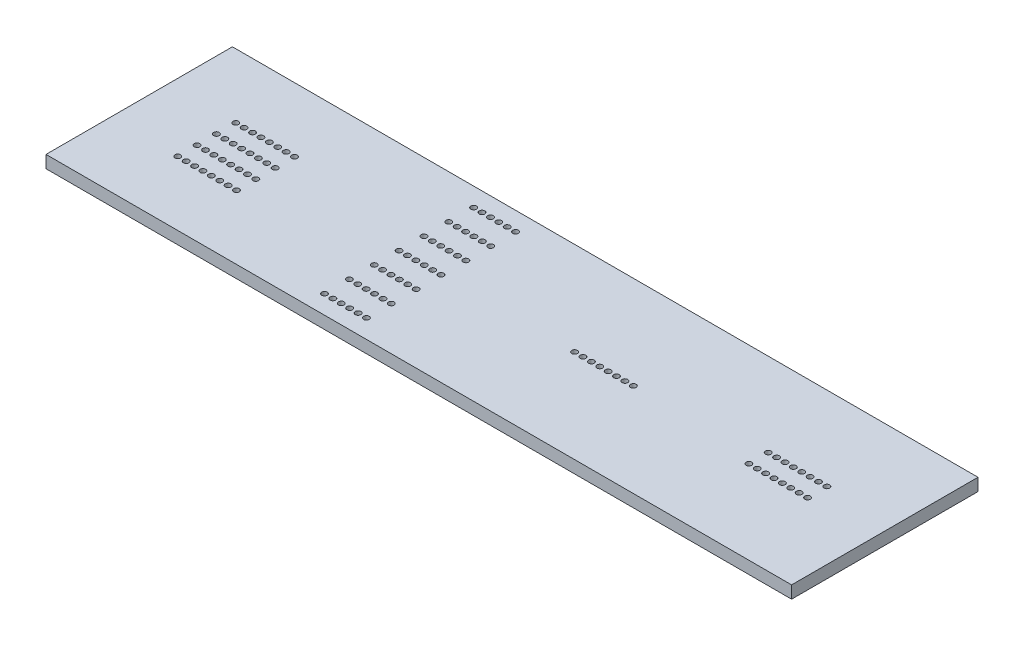
from build123d import *

# Parameters (mm, degrees)
ESQUISSE2_W                     = 120
ESQUISSE2_H                     = 30
BOSS_EXTRU_1_DEPTH              = 2
ENL_V_MAT_EXTRU_3_REACH         = 63.879
ESQUISSE8_R                     = 0.45
R_P_TITION_LIN_AIRE4_COUNT      = 8
R_P_TITION_LIN_AIRE4_PITCH      = 1.35
R_P_TITION_LIN_AIRE4_COUNT_DIR2 = 4
R_P_TITION_LIN_AIRE4_PITCH_DIR2 = 3.111
ENL_V_MAT_EXTRU_4_REACH         = 63.879
ESQUISSE10_R                    = 0.45
R_P_TITION_LIN_AIRE5_COUNT      = 6
R_P_TITION_LIN_AIRE5_PITCH      = 1.35
R_P_TITION_LIN_AIRE5_COUNT_DIR2 = 7
R_P_TITION_LIN_AIRE5_PITCH_DIR2 = 4
ENL_V_MAT_EXTRU_5_REACH         = 63.879
ESQUISSE12_R                    = 0.45
R_P_TITION_LIN_AIRE6_COUNT      = 8
R_P_TITION_LIN_AIRE6_PITCH      = 1.35
ENL_V_MAT_EXTRU_6_REACH         = 63.879
ESQUISSE14_R                    = 0.45
R_P_TITION_LIN_AIRE7_COUNT      = 8
R_P_TITION_LIN_AIRE7_PITCH      = 1.35
R_P_TITION_LIN_AIRE7_COUNT_DIR2 = 2
R_P_TITION_LIN_AIRE7_PITCH_DIR2 = 3.11


with BuildPart() as part:
    # Esquisse2 → Boss.-Extru.1 (new body)
    with BuildSketch(Plane(origin=(0, 0, 0), x_dir=(1, 0, 0), z_dir=(0, 1, 0))):
        Rectangle(ESQUISSE2_W, ESQUISSE2_H)
    extrude(amount=BOSS_EXTRU_1_DEPTH)

    # Esquisse8 → Enlèv. mat.-Extru.3 (cut, up to next)
    with BuildSketch(Plane(origin=(0, 2, 0), x_dir=(1, 0, 0), z_dir=(0, 1, 0)), mode=Mode.PRIVATE) as enl_v_mat_extru_3_sk1:
        with Locations(Location((-49.125, 4.6665, 0), (0, 0, 270))):
            Circle(ESQUISSE8_R)
    enl_v_mat_extru_3_tool1 = extrude(enl_v_mat_extru_3_sk1.sketch, amount=-ENL_V_MAT_EXTRU_3_REACH, mode=Mode.PRIVATE) & part.part
    enl_v_mat_extru_3 = enl_v_mat_extru_3_tool1.solids().sort_by_distance((-49.125, 2, -4.6665))[0]
    add(enl_v_mat_extru_3, mode=Mode.SUBTRACT)

    # Répétition linéaire4: Enl_v. mat.-Extru.3 8 × 4
    with Locations(*[(i * R_P_TITION_LIN_AIRE4_PITCH, 0, j * R_P_TITION_LIN_AIRE4_PITCH_DIR2) for i in range(R_P_TITION_LIN_AIRE4_COUNT) for j in range(R_P_TITION_LIN_AIRE4_COUNT_DIR2) if (i, j) != (0, 0)]):
        add(enl_v_mat_extru_3, mode=Mode.SUBTRACT)

    # Esquisse10 → Enlèv. mat.-Extru.4 (cut, up to next)
    with BuildSketch(Plane(origin=(0, 2, 0), x_dir=(1, 0, 0), z_dir=(0, 1, 0)), mode=Mode.PRIVATE) as enl_v_mat_extru_4_sk1:
        with Locations(Location((-18.175, 12, 0), (0, 0, 270))):
            Circle(ESQUISSE10_R)
    enl_v_mat_extru_4_tool1 = extrude(enl_v_mat_extru_4_sk1.sketch, amount=-ENL_V_MAT_EXTRU_4_REACH, mode=Mode.PRIVATE) & part.part
    enl_v_mat_extru_4 = enl_v_mat_extru_4_tool1.solids().sort_by_distance((-18.175, 2, -12))[0]
    add(enl_v_mat_extru_4, mode=Mode.SUBTRACT)

    # Répétition linéaire5: Enl_v. mat.-Extru.4 6 × 7
    with Locations(*[(i * R_P_TITION_LIN_AIRE5_PITCH, 0, j * R_P_TITION_LIN_AIRE5_PITCH_DIR2) for i in range(R_P_TITION_LIN_AIRE5_COUNT) for j in range(R_P_TITION_LIN_AIRE5_COUNT_DIR2) if (i, j) != (0, 0)]):
        add(enl_v_mat_extru_4, mode=Mode.SUBTRACT)

    # Esquisse12 → Enlèv. mat.-Extru.5 (cut, up to next)
    with BuildSketch(Plane(origin=(0, 2, 0), x_dir=(1, 0, 0), z_dir=(0, 1, 0)), mode=Mode.PRIVATE) as enl_v_mat_extru_5_sk1:
        with Locations(Location((10.075, 0, 0), (0, 0, 270))):
            Circle(ESQUISSE12_R)
    enl_v_mat_extru_5_tool1 = extrude(enl_v_mat_extru_5_sk1.sketch, amount=-ENL_V_MAT_EXTRU_5_REACH, mode=Mode.PRIVATE) & part.part
    enl_v_mat_extru_5 = enl_v_mat_extru_5_tool1.solids().sort_by_distance((10.075, 2, 0))[0]
    add(enl_v_mat_extru_5, mode=Mode.SUBTRACT)

    # Répétition linéaire6: Enlèv. mat.-Extru.5 ×8
    with Locations(*[(i * R_P_TITION_LIN_AIRE6_PITCH, 0, 0) for i in range(1, R_P_TITION_LIN_AIRE6_COUNT)]):
        add(enl_v_mat_extru_5, mode=Mode.SUBTRACT)

    # Esquisse14 → Enlèv. mat.-Extru.6 (cut, up to next)
    with BuildSketch(Plane(origin=(0, 2, 0), x_dir=(1, 0, 0), z_dir=(0, 1, 0)), mode=Mode.PRIVATE) as enl_v_mat_extru_6_sk1:
        with Locations(Location((39.675, 1.555, 0), (0, 0, 270))):
            Circle(ESQUISSE14_R)
    enl_v_mat_extru_6_tool1 = extrude(enl_v_mat_extru_6_sk1.sketch, amount=-ENL_V_MAT_EXTRU_6_REACH, mode=Mode.PRIVATE) & part.part
    enl_v_mat_extru_6 = enl_v_mat_extru_6_tool1.solids().sort_by_distance((39.675, 2, -1.555))[0]
    add(enl_v_mat_extru_6, mode=Mode.SUBTRACT)

    # Répétition linéaire7: Enl_v. mat.-Extru.6 8 × 2
    with Locations(*[(i * R_P_TITION_LIN_AIRE7_PITCH, 0, j * R_P_TITION_LIN_AIRE7_PITCH_DIR2) for i in range(R_P_TITION_LIN_AIRE7_COUNT) for j in range(R_P_TITION_LIN_AIRE7_COUNT_DIR2) if (i, j) != (0, 0)]):
        add(enl_v_mat_extru_6, mode=Mode.SUBTRACT)


solid = part.part
